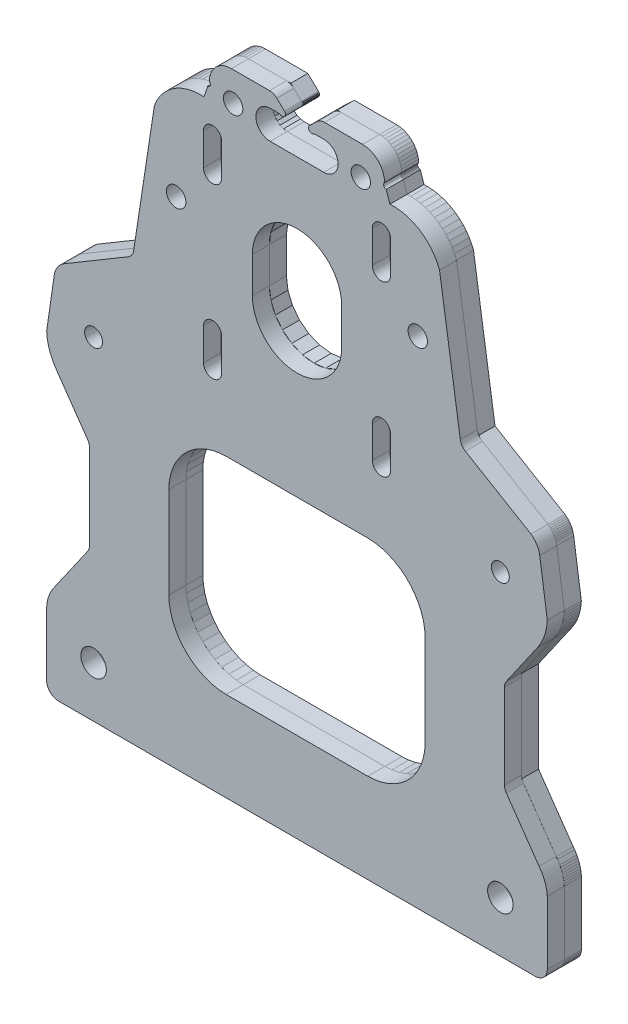
from build123d import *

# Parameters (mm, degrees)
MODEL_R             = 2.71526
MODEL_R_2           = 2.50063
MODEL_R_3           = 3.5687
BOSS_EXTRUDE2_DEPTH = 4.7625
SKETCH4_R           = 2.71526
SKETCH4_R_2         = 2.50063
SKETCH4_R_3         = 3.5687
BOSS_EXTRUDE3_DEPTH = 4.7625


with BuildPart() as part:
    # Model → Boss-Extrude2 (new body)
    with BuildSketch(Plane.XY):
        Polygon((21.295850783, -22.062118702), (20.856919497, -22.033349626), (20.425498447, -21.947534643), (20.008969366, -21.806142073), (19.614459183, -21.611591181), (19.248718077, -21.367210787), (18.918003979, -21.077182307), (18.627975499, -20.746468209), (18.383595105, -20.380727103), (18.189044213, -19.98621692), (18.047651643, -19.56968784), (17.96183666, -19.138266789), (17.933067584, -18.699335503), (17.947770543, -0.92715271), (17.99707323, -0.332653762), (18.079121308, 0.25821667), (18.193664519, 0.84365634), (18.340353489, 1.421879567), (18.518740792, 1.991122683), (18.728282322, 2.549649407), (18.968338944, 3.095756148), (19.238178448, 3.627777197), (19.863825564, 4.643119148), (20.217724856, 5.123343101), (29.931602464, 19.062226643), (29.923280879, 44.609539593), (20.631038012, 57.943873296), (19.821522687, 59.241107648), (19.467117845, 59.91882902), (19.147525812, 60.61364553), (18.863568466, 61.323770362), (18.615976041, 62.047377328), (18.405385256, 62.782605572), (18.232337675, 63.527564353), (18.097278315, 64.280337905), (18.000554498, 65.038990364), (17.942414964, 65.80157075), (17.942286482, 65.947268362), (20.062550832, 80.498169749), (20.252049146, 81.349936912), (20.393622537, 81.762942436), (20.565429754, 82.164313671), (20.76652491, 82.551840865), (20.995800876, 82.923390484), (21.251995371, 83.276916959), (21.533697914, 83.610473948), (21.839357591, 83.922225051), (22.167291589, 84.21045392), (22.515694466, 84.473573709), (42.060555579, 96.088307936), (48.080258905, 135.625131232), (48.102050008, 135.660866106), (48.646548851, 136.941631178), (49.318185318, 138.160541599), (50.110027497, 139.305017079), (51.013902839, 140.363245564), (52.020482507, 141.324305152), (53.119377663, 142.178276812), (54.299246685, 142.916346761), (55.547912227, 143.530897431), (56.852486896, 144.015586086), (58.199506268, 144.365410288), (59.575067847, 144.576759525), (60.964974559, 144.647452476), (61.953067583, 144.647452476), (62.979783525, 147.735246945), (63.136439239, 147.762425781), (63.284802471, 147.819592671), (63.419191872, 147.904558492), (63.534461199, 148.014069607), (63.626196385, 148.143932448), (63.690884568, 148.289174112), (63.726048609, 148.444232785), (63.730341954, 148.603170726), (63.703600195, 148.759901643), (63.64684737, 148.908423758), (63.562256742, 149.043049638), (63.453067583, 149.158623985), (63.505760556, 149.962563388), (63.662937881, 150.752747164), (63.921910213, 151.515655051), (64.278246461, 152.238233482), (64.725849615, 152.908118942), (65.25706106, 153.513849503), (65.862791621, 154.045060948), (66.53267708, 154.492664102), (67.255255512, 154.84900035), (68.018163399, 155.107972681), (68.808347175, 155.265150007), (69.612286578, 155.317842979), (81.453067583, 155.317842979), (84.453067583, 152.471487106), (84.604360871, 152.274317854), (84.699467809, 152.044709398), (84.731907015, 151.798309174), (84.699467811, 151.551908949), (84.604360876, 151.322300492), (84.453067583, 151.125131232), (84.255898341, 150.973837949), (84.026289885, 150.878731009), (83.779889661, 150.8462918), (83.533489436, 150.878731001), (83.303880978, 150.973837934), (83.106711724, 151.125131218), (80.453067583, 151.125131218), (79.417791403, 150.988834523), (78.453067583, 150.589232833), (77.624640459, 149.953558342), (76.988965968, 149.125131218), (76.589364278, 148.160407398), (76.453067583, 147.125131218), (76.589364278, 146.089855037), (76.988965968, 145.125131218), (77.624640459, 144.296704093), (78.453067583, 143.661029602), (79.417791403, 143.261427912), (80.453067583, 143.125131218), (95.453067583, 143.125131218), (96.488343764, 143.261427912), (97.453067583, 143.661029602), (98.281494708, 144.296704093), (98.917169198, 145.125131218), (99.316770888, 146.089855037), (99.453067583, 147.125131218), (99.316770888, 148.160407398), (98.917169198, 149.125131218), (98.281494708, 149.953558342), (97.453067583, 150.589232833), (96.488343764, 150.988834523), (95.453067583, 151.125131218), (92.799423443, 151.125131218), (92.602254188, 150.973837934), (92.37264573, 150.878731001), (92.126245505, 150.8462918), (91.879845281, 150.878731009), (91.650236826, 150.973837949), (91.453067583, 151.125131232), (91.30177429, 151.322300492), (91.206667355, 151.551908949), (91.174228152, 151.798309174), (91.206667358, 152.044709398), (91.301774295, 152.274317854), (91.453067583, 152.471487106), (94.453067583, 155.317842979), (106.293848589, 155.317842979), (107.097787991, 155.265150007), (107.887971768, 155.107972681), (108.650879654, 154.84900035), (109.373458086, 154.492664102), (110.043343545, 154.045060948), (110.649074107, 153.513849503), (111.180285552, 152.908118942), (111.627888705, 152.238233482), (111.984224954, 151.515655051), (112.243197285, 150.752747164), (112.400374611, 149.962563388), (112.453067583, 149.158623985), (112.343878425, 149.043049638), (112.259287797, 148.908423758), (112.202534971, 148.759901643), (112.175793213, 148.603170726), (112.180086558, 148.444232785), (112.215250599, 148.289174112), (112.279938781, 148.143932448), (112.371673968, 148.014069607), (112.486943295, 147.904558492), (112.621332696, 147.819592671), (112.769695928, 147.762425781), (112.926351642, 147.735246945), (113.953067583, 144.647452476), (114.941160608, 144.647452476), (116.331067319, 144.576759525), (117.706628899, 144.365410288), (119.053648271, 144.015586086), (120.35822294, 143.530897431), (121.606888481, 142.916346761), (122.786757504, 142.178276812), (123.88565266, 141.324305152), (124.892232328, 140.363245564), (125.796107669, 139.305017079), (126.587949848, 138.160541599), (127.259586316, 136.941631178), (127.804085159, 135.660866106), (133.82396705, 96.088608834), (153.368649598, 84.473573709), (153.717052475, 84.21045392), (154.044986473, 83.922225051), (154.35064615, 83.610473948), (154.632348693, 83.276916959), (154.888543188, 82.923390484), (155.117819154, 82.551840865), (155.31891431, 82.164313671), (155.490721527, 81.762942436), (155.632294917, 81.349936912), (155.821793232, 80.498169749), (157.963287707, 65.80157075), (157.905148173, 65.038990364), (157.808424357, 64.280337905), (157.673364996, 63.527564353), (157.500317415, 62.782605572), (157.28972663, 62.047377328), (157.042134205, 61.323770362), (156.758176859, 60.61364553), (156.438584827, 59.91882902), (156.084179984, 59.241107648), (155.274664659, 57.943873296), (145.982421792, 44.609539593), (145.989892045, 19.062226643), (155.703769653, 5.123343101), (156.057668945, 4.643119148), (156.683316062, 3.627777197), (156.953155566, 3.095756148), (157.193212187, 2.549649407), (157.402753717, 1.991122683), (157.581141021, 1.421879567), (157.72782999, 0.84365634), (157.842373201, 0.25821667), (157.92442128, -0.332653762), (157.973723966, -0.92715271), (157.973067583, -18.699335503), (157.944298506, -19.138266789), (157.858483524, -19.56968784), (157.717090954, -19.98621692), (157.522540062, -20.380727103), (157.278159667, -20.746468209), (156.988131187, -21.077182307), (156.657417089, -21.367210787), (156.291675983, -21.611591181), (155.897165801, -21.806142073), (155.48063672, -21.947534643), (155.04921567, -22.033349626), (154.610284383, -22.062118702), align=None)
        with Locations((54.165859409, 116.577227228)):
            Circle(MODEL_R, mode=Mode.SUBTRACT)
        with Locations((70.093453269, 147.125131232)):
            Circle(MODEL_R, mode=Mode.SUBTRACT)
        with Locations((105.812681898, 147.125131232)):
            Circle(MODEL_R, mode=Mode.SUBTRACT)
        with Locations((121.780280053, 116.577227228)):
            Circle(MODEL_R, mode=Mode.SUBTRACT)
        with Locations((31.069942582, 71.003187359)):
            Circle(MODEL_R_2, mode=Mode.SUBTRACT)
        with Locations((144.836192584, 71.003187359)):
            Circle(MODEL_R_2, mode=Mode.SUBTRACT)
        with Locations((31.061443003, -7.86681264)):
            Circle(MODEL_R_3, mode=Mode.SUBTRACT)
        with Locations((144.844692163, -7.86681264)):
            Circle(MODEL_R_3, mode=Mode.SUBTRACT)
        Polygon((109.788968306, 90.939962923), (109.385312619, 90.413904973), (109.131567318, 89.801309461), (109.045004356, 89.143908473), (109.045004356, 80.143932253), (109.131567318, 79.486531264), (109.385312619, 78.873935752), (109.788968306, 78.347877802), (110.315000857, 77.944222115), (110.927596368, 77.690476814), (111.584997357, 77.603939252), (112.242398345, 77.690476814), (112.854993857, 77.944222115), (113.381051807, 78.347877802), (113.784707494, 78.873935752), (114.038452795, 79.486531264), (114.124990357, 80.143932253), (114.124990357, 89.143908473), (114.038452795, 89.801309461), (113.784707494, 90.413904973), (113.381051807, 90.939962923), (112.854993857, 91.343593211), (112.242398345, 91.597363912), (111.584997357, 91.683901473), (110.927596368, 91.597363912), (110.315000857, 91.343593211), align=None, mode=Mode.SUBTRACT)
        Polygon((110.315000857, 125.188091916), (110.927596368, 124.934346616), (111.584997357, 124.847809054), (112.242398345, 124.934346616), (112.854993857, 125.188091916), (113.381051807, 125.591747604), (113.784707494, 126.117805554), (114.038452795, 126.730401066), (114.124990357, 127.387802054), (114.124990357, 136.387778275), (114.038452795, 137.045179263), (113.784707494, 137.657774775), (113.381051807, 138.183832725), (112.854993857, 138.587463013), (112.242398345, 138.841233713), (111.584997357, 138.927771275), (110.927596368, 138.841233713), (110.315000857, 138.587463013), (109.788968306, 138.183832725), (109.385312619, 137.657774775), (109.131567318, 137.045179263), (109.045004356, 136.387778275), (109.045004356, 127.387802054), (109.131567318, 126.730401066), (109.385312619, 126.117805554), (109.788968306, 125.591747604), align=None, mode=Mode.SUBTRACT)
        Polygon((63.071131055, 125.188091916), (63.683726567, 124.934346616), (64.341127555, 124.847809054), (64.998528543, 124.934346616), (65.611124055, 125.188091916), (66.137182005, 125.591747604), (66.540837693, 126.117805554), (66.794582994, 126.730401066), (66.881120555, 127.387802054), (66.881120555, 136.387778275), (66.794582994, 137.045179263), (66.540837693, 137.657774775), (66.137182005, 138.183832725), (65.611124055, 138.587463013), (64.998528543, 138.841233713), (64.341127555, 138.927771275), (63.683726567, 138.841233713), (63.071131055, 138.587463013), (62.545098505, 138.183832725), (62.141442817, 137.657774775), (61.887697516, 137.045179263), (61.801134555, 136.387778275), (61.801134555, 127.387802054), (61.887697516, 126.730401066), (62.141442817, 126.117805554), (62.545098505, 125.591747604), align=None, mode=Mode.SUBTRACT)
        Polygon((81.723070028, 92.432727237), (84.737831964, 91.183971955), (87.973070028, 90.758044784), (91.208308092, 91.183971955), (94.223070029, 92.432727237), (96.811904794, 94.41921002), (98.798387576, 97.008044785), (100.047142858, 100.022806721), (100.473070029, 103.258044785), (100.473069733, 113.258045083), (100.047142561, 116.493283147), (98.79838728, 119.508045084), (96.811904497, 122.096879849), (94.223069732, 124.083362632), (91.208307795, 125.332117913), (87.973069731, 125.758045084), (84.737831667, 125.332117913), (81.723069731, 124.083362632), (79.134234966, 122.096879849), (77.147752183, 119.508045084), (75.898996902, 116.493283147), (75.47306973, 113.258045083), (75.473070027, 103.258044785), (75.898997198, 100.022806721), (77.14775248, 97.008044785), (79.134235263, 94.41921002), align=None, mode=Mode.SUBTRACT)
        Polygon((63.071131055, 77.944222115), (63.683726567, 77.690476814), (64.341127555, 77.603939252), (64.998528543, 77.690476814), (65.611124055, 77.944222115), (66.137182005, 78.347877802), (66.540837693, 78.873935752), (66.794582994, 79.486531264), (66.881120555, 80.143932253), (66.881120555, 89.143908473), (66.794582994, 89.801309461), (66.540837693, 90.413904973), (66.137182005, 90.939962923), (65.611124055, 91.343593211), (64.998528543, 91.597363912), (64.341127555, 91.683901473), (63.683726567, 91.597363912), (63.071131055, 91.343593211), (62.545098505, 90.939962923), (62.141442817, 90.413904973), (61.887697516, 89.801309461), (61.801134555, 89.143908473), (61.801134555, 80.143932253), (61.887697516, 79.486531264), (62.141442817, 78.873935752), (62.545098505, 78.347877802), align=None, mode=Mode.SUBTRACT)
        Polygon((60.223601338, 5.15179938), (62.132144512, 4.210610044), (64.147209694, 3.526587586), (66.234318561, 3.11143582), (68.149882626, 2.985883118), (107.756252541, 2.985883118), (109.671816605, 3.11143582), (111.758925473, 3.526587586), (113.773990655, 4.210610044), (115.682533829, 5.15179938), (117.451899291, 6.334051585), (119.051812707, 7.737137994), (120.454899116, 9.337051411), (121.637151321, 11.106416873), (122.578340657, 13.014960046), (123.262363115, 15.030025229), (123.677514881, 17.117134096), (123.803067583, 19.032698161), (123.803067583, 44.639068075), (123.677514881, 46.55463214), (123.262363115, 48.641741007), (122.578340657, 50.65680619), (121.637151321, 52.565349363), (120.454899116, 54.334714825), (119.051812707, 55.934628242), (117.451899291, 57.337714651), (115.682533829, 58.519966855), (113.773990655, 59.461156192), (111.758925473, 60.14517865), (109.671816605, 60.560330416), (107.756252541, 60.685883118), (68.149882626, 60.685883118), (66.234318561, 60.560330416), (64.147209694, 60.14517865), (62.132144512, 59.461156192), (60.223601338, 58.519966855), (58.454235876, 57.337714651), (56.854322459, 55.934628242), (55.45123605, 54.334714825), (54.268983846, 52.565349363), (53.327794509, 50.65680619), (52.643772051, 48.641741007), (52.228620285, 46.55463214), (52.103067583, 44.639068075), (52.103067583, 19.032698161), (52.228620285, 17.117134096), (52.643772051, 15.030025229), (53.327794509, 13.014960046), (54.268983846, 11.106416873), (55.45123605, 9.337051411), (56.854322459, 7.737137994), (58.454235876, 6.334051585), align=None, mode=Mode.SUBTRACT)
    extrude(amount=BOSS_EXTRUDE2_DEPTH)


with BuildPart() as body_2:
    # Sketch4 → Boss-Extrude3 (new body)
    with BuildSketch(Plane.XY.offset(4.7625)):
        with BuildLine():
            Line((20.631038012, 57.943873296), (29.384902069, 45.382111169))
            ThreePointArc((29.384902069, 45.382111169), (29.785603352, 44.566275305), (29.923587607, 43.667882283))
            Line((29.923587607, 43.667882283), (29.931295378, 20.004984959))
            ThreePointArc((29.931295378, 20.004984959), (29.79359645, 19.105546031), (29.3925813, 18.288760728))
            Line((29.3925813, 18.288760728), (20.217724856, 5.123343101))
            ThreePointArc((20.217724856, 5.123343101), (18.619655019, 2.271832896), (17.947770543, -0.92715271))
            Line((17.947770543, -0.92715271), (17.933067584, -18.699335503))
            ThreePointArc((17.933067584, -18.699335503), (18.918003979, -21.077182307), (21.295850783, -22.062118702))
            Line((21.295850783, -22.062118702), (154.610284383, -22.062118702))
            ThreePointArc((154.610284383, -22.062118702), (156.988131187, -21.077182307), (157.973067583, -18.699335503))
            Line((157.973067583, -18.699335503), (157.958364624, -0.92715271))
            ThreePointArc((157.958364624, -0.92715271), (157.286480147, 2.271832896), (155.68841031, 5.123343101))
            Line((155.68841031, 5.123343101), (146.513553866, 18.288760728))
            ThreePointArc((146.513553866, 18.288760728), (146.112538717, 19.105546031), (145.974839789, 20.004984959))
            Line((145.974839789, 20.004984959), (145.982547559, 43.667882283))
            ThreePointArc((145.982547559, 43.667882283), (146.120531815, 44.566275305), (146.521233098, 45.382111169))
            Line((146.521233098, 45.382111169), (155.275097154, 57.943873296))
            ThreePointArc((155.275097154, 57.943873296), (157.194446743, 61.752407586), (157.963848685, 65.947268362))
            Line((157.963848685, 65.947268362), (155.843584335, 80.498169749))
            ThreePointArc((155.843584335, 80.498169749), (155.028419541, 82.739742916), (153.390440701, 84.473573709))
            Line((153.390440701, 84.473573709), (135.065254278, 95.363503738))
            ThreePointArc((135.065254278, 95.363503738), (134.109790952, 96.266305409), (133.632022917, 97.490927281))
            Line((133.632022917, 97.490927281), (127.825876262, 135.625131232))
            ThreePointArc((127.825876262, 135.625131232), (122.391204621, 142.44537062), (113.953067583, 144.647452476))
            Line((113.953067583, 144.647452476), (112.926351642, 147.735246945))
            ThreePointArc((112.926351642, 147.735246945), (112.218979224, 148.290413909), (112.453067583, 149.158623985))
            ThreePointArc((112.453067583, 149.158623985), (110.649074107, 153.513849503), (106.293848589, 155.317842979))
            Line((106.293848589, 155.317842979), (95.649782195, 155.317842979))
            ThreePointArc((95.649782195, 155.317842979), (94.538241316, 155.104324071), (93.584923767, 154.494160896))
            Line((93.584923767, 154.494160896), (91.453067583, 152.471487106))
            ThreePointArc((91.453067583, 152.471487106), (91.453067576, 151.125131239), (92.799423443, 151.125131218))
            Line((92.799423443, 151.125131218), (95.453067583, 151.125131218))
            ThreePointArc((95.453067583, 151.125131218), (99.453067583, 147.125131218), (95.453067583, 143.125131218))
            Line((95.453067583, 143.125131218), (80.453067583, 143.125131218))
            ThreePointArc((80.453067583, 143.125131218), (76.453067583, 147.125131218), (80.453067583, 151.125131218))
            Line((80.453067583, 151.125131218), (83.106711724, 151.125131218))
            ThreePointArc((83.106711724, 151.125131218), (84.45306759, 151.125131239), (84.453067583, 152.471487106))
            Line((84.453067583, 152.471487106), (82.3212114, 154.494160896))
            ThreePointArc((82.3212114, 154.494160896), (81.367893851, 155.104324071), (80.256352972, 155.317842979))
            Line((80.256352972, 155.317842979), (69.612286578, 155.317842979))
            ThreePointArc((69.612286578, 155.317842979), (65.25706106, 153.513849503), (63.453067583, 149.158623985))
            ThreePointArc((63.453067583, 149.158623985), (63.687155943, 148.290413909), (62.979783525, 147.735246945))
            Line((62.979783525, 147.735246945), (61.953067583, 144.647452476))
            ThreePointArc((61.953067583, 144.647452476), (53.514930546, 142.44537062), (48.080258905, 135.625131232))
            Line((48.080258905, 135.625131232), (42.27411225, 97.490927281))
            ThreePointArc((42.27411225, 97.490927281), (41.796344215, 96.266305409), (40.840880888, 95.363503738))
            Line((40.840880888, 95.363503738), (22.515694466, 84.473573709))
            ThreePointArc((22.515694466, 84.473573709), (20.877715626, 82.739742916), (20.062550832, 80.498169749))
            Line((20.062550832, 80.498169749), (17.942286482, 65.947268362))
            ThreePointArc((17.942286482, 65.947268362), (18.711688423, 61.752407586), (20.631038012, 57.943873296))
        make_face()
        with Locations((70.093453269, 147.125131232)):
            Circle(SKETCH4_R, mode=Mode.SUBTRACT)
        with Locations((54.165859409, 116.577227228)):
            Circle(SKETCH4_R, mode=Mode.SUBTRACT)
        with Locations((31.069942582, 71.003187359)):
            Circle(SKETCH4_R_2, mode=Mode.SUBTRACT)
        with Locations((121.740275757, 116.577227228)):
            Circle(SKETCH4_R, mode=Mode.SUBTRACT)
        with Locations((105.812681898, 147.125131232)):
            Circle(SKETCH4_R, mode=Mode.SUBTRACT)
        with Locations((144.836192584, 71.003187359)):
            Circle(SKETCH4_R_2, mode=Mode.SUBTRACT)
        with Locations((31.061443003, -7.86681264)):
            Circle(SKETCH4_R_3, mode=Mode.SUBTRACT)
        with Locations((144.844692163, -7.86681264)):
            Circle(SKETCH4_R_3, mode=Mode.SUBTRACT)
        with BuildLine():
            Line((68.149882626, 2.985883118), (107.756252541, 2.985883118))
            ThreePointArc((107.756252541, 2.985883118), (119.051812707, 7.737137994), (123.803067583, 19.032698161))
            Line((123.803067583, 19.032698161), (123.803067583, 44.639068075))
            ThreePointArc((123.803067583, 44.639068075), (119.051812707, 55.934628242), (107.756252541, 60.685883118))
            Line((107.756252541, 60.685883118), (68.149882626, 60.685883118))
            ThreePointArc((68.149882626, 60.685883118), (56.854322459, 55.934628242), (52.103067583, 44.639068075))
            Line((52.103067583, 44.639068075), (52.103067583, 19.032698161))
            ThreePointArc((52.103067583, 19.032698161), (56.854322459, 7.737137994), (68.149882626, 2.985883118))
        make_face(mode=Mode.SUBTRACT)
        with BuildLine():
            Line((66.881120555, 136.387778275), (66.881120555, 127.387802054))
            ThreePointArc((66.881120555, 127.387802054), (64.341127555, 124.847797803), (61.801134555, 127.387802054))
            Line((61.801134555, 127.387802054), (61.801134555, 136.387778275))
            ThreePointArc((61.801134555, 136.387778275), (64.341127555, 138.927771275), (66.881120555, 136.387778275))
        make_face(mode=Mode.SUBTRACT)
        with BuildLine():
            Line((66.881120555, 89.143908473), (66.881120555, 80.143932253))
            ThreePointArc((66.881120555, 80.143932253), (64.341127555, 77.603927578), (61.801134555, 80.143932253))
            Line((61.801134555, 80.143932253), (61.801134555, 89.143908473))
            ThreePointArc((61.801134555, 89.143908473), (64.341127555, 91.683887748), (66.881120555, 89.143908473))
        make_face(mode=Mode.SUBTRACT)
        with BuildLine():
            Line((114.105000612, 136.387778275), (114.105000612, 127.387802054))
            ThreePointArc((114.105000612, 127.387802054), (111.565007612, 124.847797803), (109.025014612, 127.387802054))
            Line((109.025014612, 127.387802054), (109.025014612, 136.387778275))
            ThreePointArc((109.025014612, 136.387778275), (111.565007612, 138.927771275), (114.105000612, 136.387778275))
        make_face(mode=Mode.SUBTRACT)
        with BuildLine():
            Line((114.105000612, 89.143908473), (114.105000612, 80.143932253))
            ThreePointArc((114.105000612, 80.143932253), (111.565007612, 77.603927578), (109.025014612, 80.143932253))
            Line((109.025014612, 80.143932253), (109.025014612, 89.143908473))
            ThreePointArc((109.025014612, 89.143908473), (111.565007612, 91.683887748), (114.105000612, 89.143908473))
        make_face(mode=Mode.SUBTRACT)
        with BuildLine():
            Line((75.47306973, 113.258045083), (75.473070027, 103.258044785))
            ThreePointArc((75.473070027, 103.258044785), (87.973070028, 90.758044784), (100.473070029, 103.258044785))
            Line((100.473070029, 103.258044785), (100.473069733, 113.258045083))
            ThreePointArc((100.473069733, 113.258045083), (87.973069731, 125.758045084), (75.47306973, 113.258045083))
        make_face(mode=Mode.SUBTRACT)
    extrude(amount=BOSS_EXTRUDE3_DEPTH)


solid = Compound([part.part, body_2.part])
